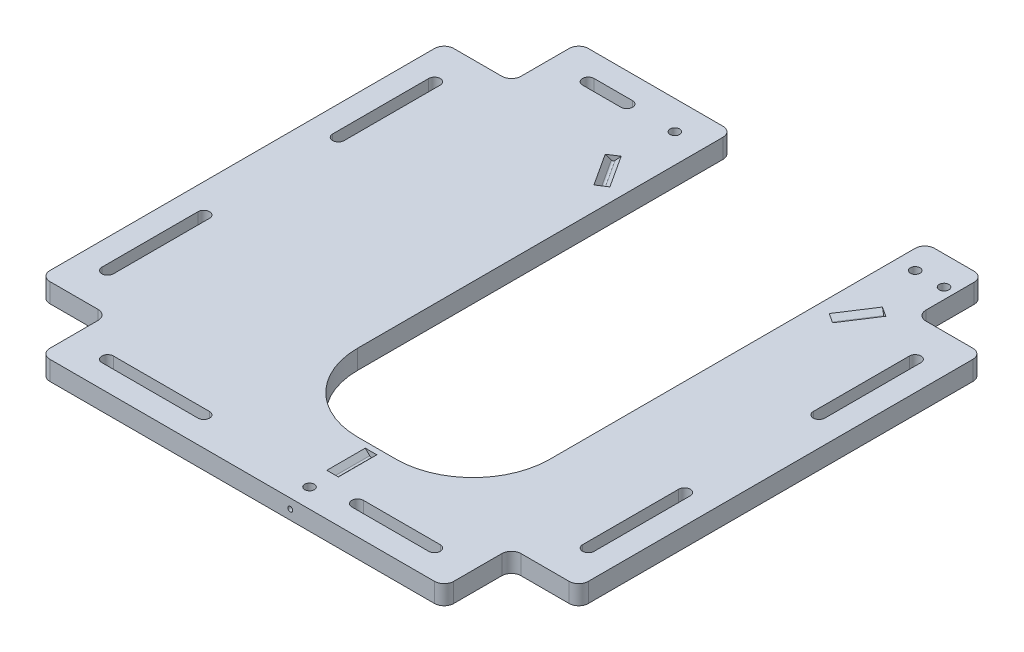
from build123d import *

# Parameters (mm, degrees)
SKETCH1_R               = 2.5
BOSS_EXTRUDE1_DEPTH     = 10
FILLET1_R               = 40
FILLET2_R               = 5
SKETCH11_R              = 2.5
CUT_EXTRUDE5_DEPTH      = 240.892586362
M3_TAPPED_HOLE2_D       = 2.5
M3_TAPPED_HOLE2_DEPTH   = 20.1
M3_TAPPED_HOLE2_TIP     = 0.751075774
CUT_EXTRUDE6_DEPTH      = 10
CUT_EXTRUDE6_DEPTH_BACK = 10
CUT_EXTRUDE7_DEPTH      = 10
CUT_EXTRUDE7_DEPTH_BACK = 10
CUT_EXTRUDE8_DEPTH      = 12
CUT_EXTRUDE8_DEPTH_BACK = 8
M3_TAPPED_HOLE1_D       = 2.5
M3_TAPPED_HOLE1_DEPTH   = 21.5
M3_TAPPED_HOLE1_TIP     = 0.751075774
FILLET3_R               = 1


with BuildPart() as part:
    # Sketch1 → Boss-Extrude1 (new body)
    with BuildSketch(Plane(origin=(0, 0, 0), x_dir=(1, 0, 0), z_dir=(0, 1, 0))):
        Polygon((145.743589744, -54.717948718), (145.743589744, 155.282051282), (111.34930004, 155.282051282), (111.34930004, 190.282051282), (80.743589744, 190.282051282), (80.743589744, -44.717948718), (-19.256410256, -44.717948718), (-19.256410256, 190.282051282), (-99.256410256, 190.282051282), (-99.256410256, 155.282051282), (-134.256410256, 155.282051282), (-134.256410256, -54.717948718), (-99.256410256, -54.717948718), (-99.256410256, -89.717948718), (110.743589744, -89.717948718), (110.743589744, -54.717948718), align=None)
        with BuildLine():
            ThreePointArc((-79.256410256, -77.717948718), (-82.256410256, -74.717948718), (-79.256410256, -71.717948718))
            Line((-79.256410256, -71.717948718), (-29.256410256, -71.717948718))
            ThreePointArc((-29.256410256, -71.717948718), (-26.256410256, -74.717948718), (-29.256410256, -77.717948718))
            Line((-29.256410256, -77.717948718), (-79.256410256, -77.717948718))
        make_face(mode=Mode.SUBTRACT)
        with BuildLine():
            ThreePointArc((-116.256410256, -34.717948718), (-119.256410256, -37.717948718), (-122.256410256, -34.717948718))
            Line((-122.256410256, -34.717948718), (-122.256410256, 15.282051282))
            ThreePointArc((-122.256410256, 15.282051282), (-119.256410256, 18.282051282), (-116.256410256, 15.282051282))
            Line((-116.256410256, 15.282051282), (-116.256410256, -34.717948718))
        make_face(mode=Mode.SUBTRACT)
        with BuildLine():
            ThreePointArc((50.743589744, -77.717948718), (47.743589744, -74.717948718), (50.743589744, -71.717948718))
            Line((50.743589744, -71.717948718), (90.743589744, -71.717948718))
            ThreePointArc((90.743589744, -71.717948718), (93.743589744, -74.717948718), (90.743589744, -77.717948718))
            Line((90.743589744, -77.717948718), (50.743589744, -77.717948718))
        make_face(mode=Mode.SUBTRACT)
        with BuildLine():
            ThreePointArc((133.743589744, -34.717948718), (130.743589744, -37.717948718), (127.743589744, -34.717948718))
            Line((127.743589744, -34.717948718), (127.743589744, 15.282051282))
            ThreePointArc((127.743589744, 15.282051282), (130.743589744, 18.282051282), (133.743589744, 15.282051282))
            Line((133.743589744, 15.282051282), (133.743589744, -34.717948718))
        make_face(mode=Mode.SUBTRACT)
        with BuildLine():
            ThreePointArc((-122.256410256, 135.282051282), (-119.256410256, 138.282051282), (-116.256410256, 135.282051282))
            Line((-116.256410256, 135.282051282), (-116.256410256, 85.282051282))
            ThreePointArc((-116.256410256, 85.282051282), (-119.256410256, 82.282051282), (-122.256410256, 85.282051282))
            Line((-122.256410256, 85.282051282), (-122.256410256, 135.282051282))
        make_face(mode=Mode.SUBTRACT)
        with BuildLine():
            ThreePointArc((-79.256410256, 172.282051282), (-82.256410256, 175.282051282), (-79.256410256, 178.282051282))
            Line((-79.256410256, 178.282051282), (-59.256410256, 178.282051282))
            ThreePointArc((-59.256410256, 178.282051282), (-56.256410256, 175.282051282), (-59.256410256, 172.282051282))
            Line((-59.256410256, 172.282051282), (-79.256410256, 172.282051282))
        make_face(mode=Mode.SUBTRACT)
        with BuildLine():
            ThreePointArc((127.743589744, 135.282051282), (130.743589744, 138.282051282), (133.743589744, 135.282051282))
            Line((133.743589744, 135.282051282), (133.743589744, 85.282051282))
            ThreePointArc((133.743589744, 85.282051282), (130.743589744, 82.282051282), (127.743589744, 85.282051282))
            Line((127.743589744, 85.282051282), (127.743589744, 135.282051282))
        make_face(mode=Mode.SUBTRACT)
        with Locations((105.743589744, 175.282051282)):
            Circle(SKETCH1_R, mode=Mode.SUBTRACT)
    extrude(amount=BOSS_EXTRUDE1_DEPTH)

    # Fillet1
    fillet1_edges = [part.edges().sort_by_distance(p)[0] for p in [
        (80.743589744, 5, 44.717948718),
        (-19.256410256, 5, 44.717948718),
    ]]
    fillet(fillet1_edges, radius=FILLET1_R)

    # Fillet2
    fillet2_edges = [part.edges().sort_by_distance(p)[0] for p in [
        (-134.256410256, 5, 54.717948718),
        (-99.256410256, 5, 54.717948718),
        (-99.256410256, 5, 89.717948718),
        (110.743589744, 5, 89.717948718),
        (110.743589744, 5, 54.717948718),
        (145.743589744, 5, 54.717948718),
        (111.34930004, 5, -155.282051282),
        (145.743589744, 5, -155.282051282),
        (111.34930004, 5, -190.282051282),
        (80.743589744, 5, -190.282051282),
        (-19.256410256, 5, -190.282051282),
        (-99.256410256, 5, -190.282051282),
        (-99.256410256, 5, -155.282051282),
        (-134.256410256, 5, -155.282051282),
    ]]
    fillet(fillet2_edges, radius=FILLET2_R)

    # Sketch11 → Cut-Extrude5 (cut, through all)
    with BuildSketch(Plane(origin=(0, 10, 0), x_dir=(1, 0, 0), z_dir=(0, 1, 0))):
        with Locations((-34.256410256, 175.282051282)):
            Circle(SKETCH11_R)
        with Locations((90.743589744, 175.282051282)):
            Circle(SKETCH11_R)
        with Locations((30.743589744, -79.717948718)):
            Circle(SKETCH11_R)
    extrude(amount=-CUT_EXTRUDE5_DEPTH, mode=Mode.SUBTRACT)

    # M3 Tapped Hole2
    with Locations(Plane.XY.offset(89.717948718)):
        with Locations((30.743589744, 5)):
            Hole(M3_TAPPED_HOLE2_D / 2, depth=M3_TAPPED_HOLE2_DEPTH)
            with Locations((0, 0, -(M3_TAPPED_HOLE2_DEPTH + M3_TAPPED_HOLE2_TIP / 2))):  # 118° drill point
                Cone(0, M3_TAPPED_HOLE2_D / 2, M3_TAPPED_HOLE2_TIP, mode=Mode.SUBTRACT)

    # Sketch26 → Cut-Extrude6 (cut, two sides: drawn at the far end of the back side and taken through both)
    with BuildSketch(Plane(origin=(92.537785589, 0, -142.365823983), x_dir=(0.838443616300637, 0, 0.5449883505954143), z_dir=(0.5449883505954143, 0, -0.838443616300637)).offset(-CUT_EXTRUDE6_DEPTH_BACK)):
        Polygon((0.823517876, -10), (3.823517876, -7), (6.823517876, -10), align=None)
    extrude(amount=CUT_EXTRUDE6_DEPTH + CUT_EXTRUDE6_DEPTH_BACK, mode=Mode.SUBTRACT)

    # Sketch27 → Cut-Extrude7 (cut, two sides: drawn at the far end of the back side and taken through both)
    with BuildSketch(Plane(origin=(-74.275336848, 0, -114.269748997), x_dir=(-0.8384436163006375, 0, 0.5449883505954137), z_dir=(0.5449883505954136, 0, 0.8384436163006374)).offset(-CUT_EXTRUDE7_DEPTH_BACK)):
        Polygon((-50.730015249, -10), (-47.730015249, -7), (-44.730015249, -10), align=None)
    extrude(amount=CUT_EXTRUDE7_DEPTH + CUT_EXTRUDE7_DEPTH_BACK, mode=Mode.SUBTRACT)

    # Sketch28 → Cut-Extrude8 (cut, two sides: drawn at the far end of the back side and taken through both)
    with BuildSketch(Plane(origin=(0, 0, 59.717948718), x_dir=(1, 0, 0), z_dir=(0, 0, -1)).offset(-CUT_EXTRUDE8_DEPTH_BACK)):
        Polygon((27.743589744, -10), (33.743589744, -10), (30.743589744, -7), align=None)
    extrude(amount=CUT_EXTRUDE8_DEPTH + CUT_EXTRUDE8_DEPTH_BACK, mode=Mode.SUBTRACT)

    # M3 Tapped Hole1
    with Locations(Plane(origin=(0, 0, -190.282051282), x_dir=(-1, 0, 0), z_dir=(0, 0, -1))):
        with Locations((34.256410256, 5), (-90.743589744, 5)):
            Hole(M3_TAPPED_HOLE1_D / 2, depth=M3_TAPPED_HOLE1_DEPTH)
            with Locations((0, 0, -(M3_TAPPED_HOLE1_DEPTH + M3_TAPPED_HOLE1_TIP / 2))):  # 118° drill point
                Cone(0, M3_TAPPED_HOLE1_D / 2, M3_TAPPED_HOLE1_TIP, mode=Mode.SUBTRACT)

    # Fillet3
    fillet3_edges = [part.edges().sort_by_distance(p)[0] for p in [
        (30.743589744, 7, 57.717948718),
        (95.743589744, 7, -140.282051282),
        (-34.256410256, 7, -140.282051282),
    ]]
    fillet(fillet3_edges, radius=FILLET3_R)


solid = part.part
